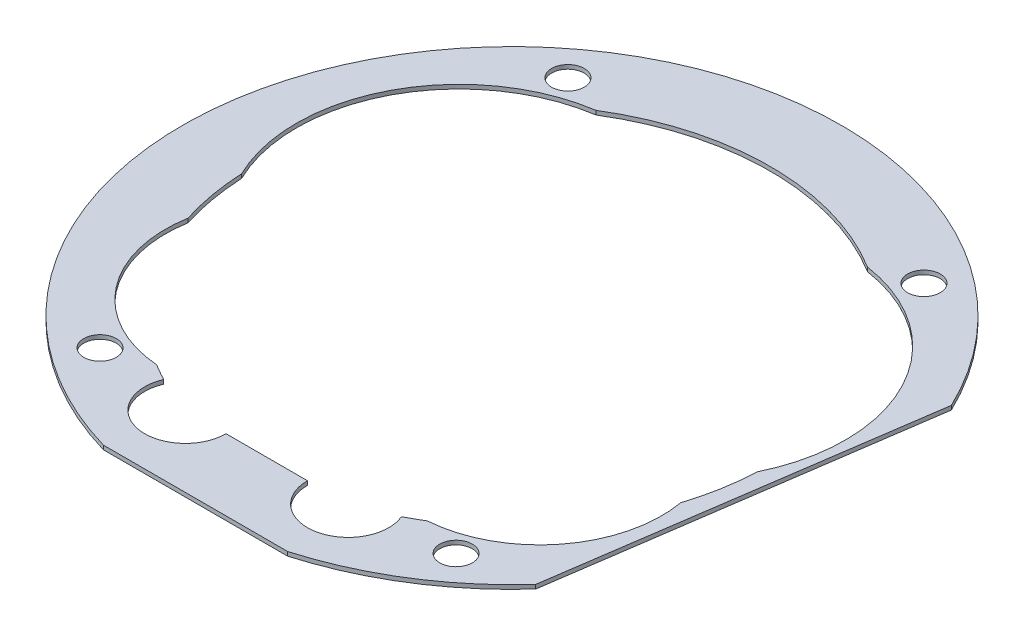
from build123d import *

# Parameters (mm, degrees)
SKETCH1_R           = 1.6
BOSS_EXTRUDE1_DEPTH = 0.4


with BuildPart() as part:
    # Sketch1 → Boss-Extrude1 (new body)
    with BuildSketch(Plane(origin=(0, 0, 0), x_dir=(1, 0, 0), z_dir=(0, 1, 0))):
        with BuildLine():
            Line((29.237843605, 13.960963482), (24.049079653, -21.711788683))
            ThreePointArc((24.049079653, -21.711788683), (17.208573183, -27.452231403), (9.060814288, -31.107260317))
            Line((9.060814288, -31.107260317), (-9.060814288, -31.107260317))
            ThreePointArc((-9.060814288, -31.107260317), (-24.689356555, 20.980840614), (29.237843605, 13.960963482))
        make_face()
        with Locations(Location((-17.5, 23, 0), (0, 0, 270))):
            Circle(SKETCH1_R, mode=Mode.SUBTRACT)
        with Locations(Location((-17.5, -23, 0), (0, 0, 270))):
            Circle(SKETCH1_R, mode=Mode.SUBTRACT)
        with Locations(Location((17.5, -23, 0), (0, 0, 270))):
            Circle(SKETCH1_R, mode=Mode.SUBTRACT)
        with Locations(Location((17.5, 23, 0), (0, 0, 270))):
            Circle(SKETCH1_R, mode=Mode.SUBTRACT)
        with BuildLine():
            Line((-4, -24.107260317), (4, -24.107260317))
            ThreePointArc((4, -24.107260317), (8.793181532, -28.027829543), (11.685431528, -22.552398764))
            ThreePointArc((11.685431528, -22.552398764), (12.499954018, -22.111335318), (13.297853098, -21.640866502))
            ThreePointArc((13.297853098, -21.640866502), (21.8608918, -17.056148201), (24.225281505, -7.63516444))
            ThreePointArc((24.225281505, -7.63516444), (25.005340406, -4.460151477), (25.371103528, -1.211241423))
            ThreePointArc((25.371103528, -1.211241423), (25.13782952, 13.24356348), (13.348031622, 21.609952611))
            ThreePointArc((13.348031622, 21.609952611), (0, 25.4), (-13.348031622, 21.609952611))
            ThreePointArc((-13.348031622, 21.609952611), (-25.13782952, 13.24356348), (-25.371103528, -1.211241423))
            ThreePointArc((-25.371103528, -1.211241423), (-25.005340406, -4.460151477), (-24.225281505, -7.63516444))
            ThreePointArc((-24.225281505, -7.63516444), (-21.8608918, -17.056148201), (-13.297853098, -21.640866502))
            ThreePointArc((-13.297853098, -21.640866502), (-12.499954018, -22.111335318), (-11.685431528, -22.552398764))
            ThreePointArc((-11.685431528, -22.552398764), (-8.793181532, -28.027829543), (-4, -24.107260317))
        make_face(mode=Mode.SUBTRACT)
    extrude(amount=BOSS_EXTRUDE1_DEPTH)


solid = part.part
